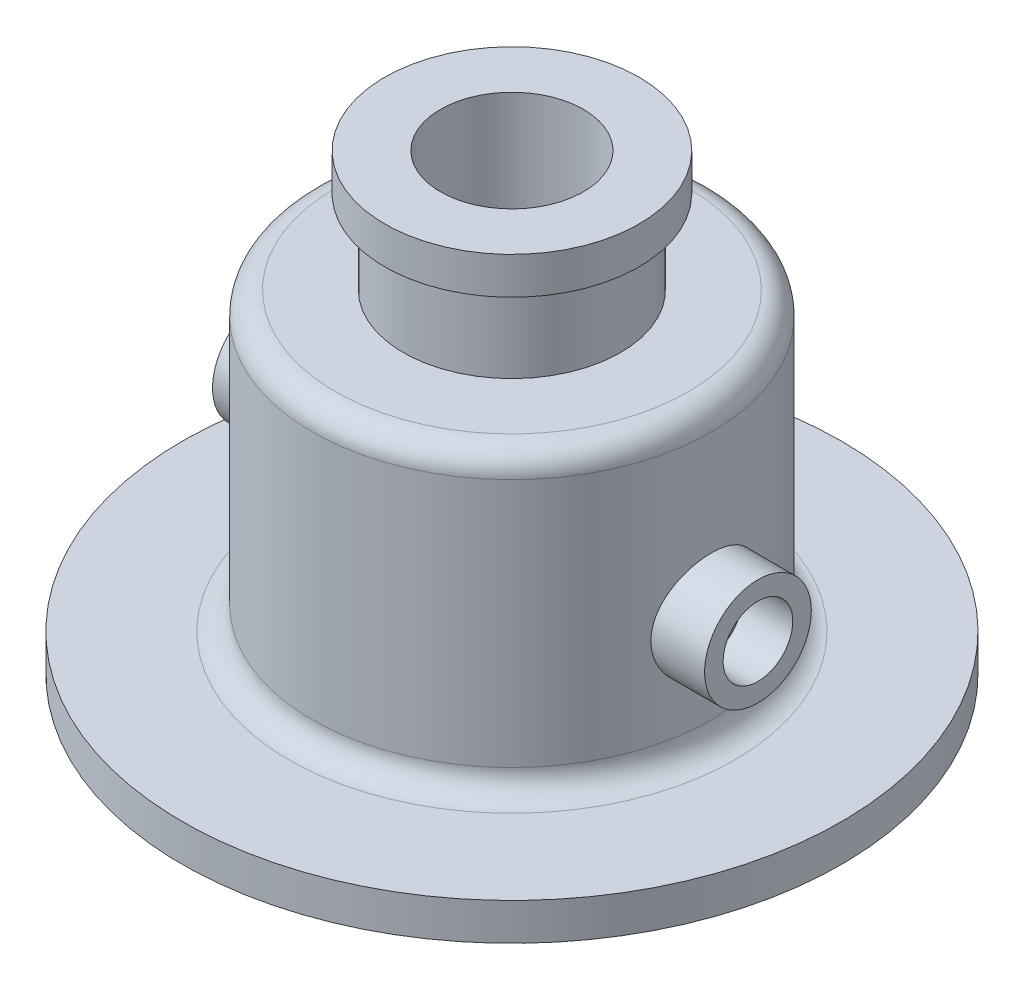
from build123d import *

# Parameters (mm, degrees)
CHAMFER1_SIZE       = 2
SKETCH2_R           = 11.5
SKETCH2_R_2         = 7.5
BOSS_EXTRUDE1_DEPTH = 106
SKETCH3_W           = 35
SKETCH3_H           = 38.00491486


with BuildPart() as part:
    # Sketch1 → Revolve1 (revolve)
    with BuildSketch(Plane.XY):
        with BuildLine():
            Line((15.4, 52.7), (15.4, 16.7))
            Line((15.4, 16.7), (23.4, 16.7))
            Line((23.4, 16.7), (23.4, 18.7))
            Line((23.4, 18.7), (30, 18.7))
            ThreePointArc((30, 18.7), (33.535533906, 17.235533906), (35, 13.7))
            Line((35, 13.7), (35, -27))
            ThreePointArc((35, -27), (33.535533906, -30.535533906), (30, -32))
            Line((30, -32), (25, -32))
            Line((25, -32), (25, -50))
            Line((25, -50), (32, -50))
            Line((32, -50), (32, -47))
            ThreePointArc((32, -47), (32.585786438, -45.585786438), (34, -45))
            Line((34, -45), (71, -45))
            Line((71, -45), (71, -37))
            Line((71, -37), (48, -37))
            ThreePointArc((48, -37), (44.464466094, -35.535533906), (43, -32))
            Line((43, -32), (43, 21.7))
            ThreePointArc((43, 21.7), (41.535533906, 25.235533906), (38, 26.7))
            Line((38, 26.7), (23.4, 26.7))
            Line((23.4, 26.7), (23.4, 44.7))
            Line((23.4, 44.7), (27.4, 44.7))
            Line((27.4, 44.7), (27.4, 52.7))
            Line((27.4, 52.7), (15.4, 52.7))
        make_face()
    revolve(axis=Axis((0, 0, 0), (0, 1, 0)))

    # Chamfer1
    chamfer1_edges = [part.edges().sort_by_distance(p)[0] for p in [
        (-15.4, 16.7, 0),
    ]]
    chamfer(chamfer1_edges, length=CHAMFER1_SIZE)

    # Sketch2 → Boss-Extrude1 (add)
    with BuildSketch(Plane(origin=(53, 0, 0), x_dir=(0, 0, -1), z_dir=(1, 0, 0))):
        with Locations((0, -12.35)):
            Circle(SKETCH2_R)
        with Locations((0, -12.35)):
            Circle(SKETCH2_R_2, mode=Mode.SUBTRACT)
    extrude(amount=-BOSS_EXTRUDE1_DEPTH)

    # Sketch3 → Cut-Revolve1 (revolve, cut)
    with BuildSketch(Plane(origin=(0, 0, 0), x_dir=(0, 0, -1), z_dir=(1, 0, 0))):
        with Locations((17.5, -8.912930595)):
            Rectangle(SKETCH3_W, SKETCH3_H)
    revolve(axis=Axis((0, 14.900275551, 0), (0, -1, 0)), mode=Mode.SUBTRACT)


solid = part.part
